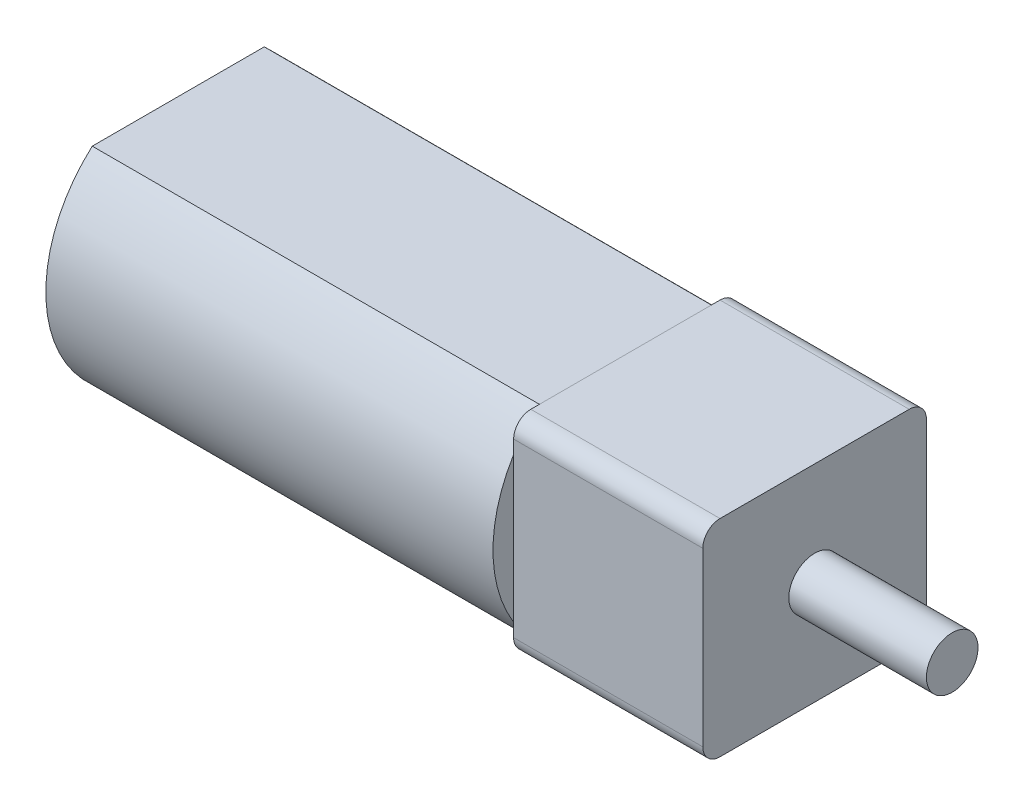
from build123d import *

# Parameters (mm, degrees)
EXTRUDE_1_DEPTH = 26
SKETCH_2_W      = 13
SKETCH_2_H      = 12
EXTRUDE_2_DEPTH = 11
SKETCH_3_R      = 1.5
EXTRUDE_3_DEPTH = 8
SKETCH_4_R      = 2.5
EXTRUDE_4_DEPTH = 2
FILLET_1_R      = 0.5
FILLET_2_R      = 1


with BuildPart() as part:
    # Эскиз1 → Бобышка-Вытянуть1 (new body)
    with BuildSketch(Plane(origin=(0, 0, 0), x_dir=(0, 0, -1), z_dir=(1, 0, 0))):
        with BuildLine():
            Line((2.7, 12), (12.7, 12))
            ThreePointArc((12.7, 12), (15.4, 6), (12.7, 0))
            Line((12.7, 0), (2.7, 0))
            ThreePointArc((2.7, 0), (0, 6), (2.7, 12))
        make_face()
    extrude(amount=EXTRUDE_1_DEPTH)

    # Эскиз4 → Бобышка-Вытянуть4 (add)
    with BuildSketch(Plane.ZY):
        with Locations((-7.7, 6)):
            Circle(SKETCH_4_R)
    extrude(amount=EXTRUDE_4_DEPTH)

    # Скругление1
    fillet_1_edges = [part.edges().sort_by_distance(p)[0] for p in [
        (-2, 6, -10.2),
    ]]
    fillet(fillet_1_edges, radius=FILLET_1_R)


with BuildPart() as body_2:
    # Эскиз2 → Бобышка-Вытянуть2 (new body)
    with BuildSketch(Plane(origin=(26, 0, 0), x_dir=(0, 0, -1), z_dir=(1, 0, 0))):
        with Locations((7.7, 6)):
            Rectangle(SKETCH_2_W, SKETCH_2_H)
    extrude(amount=EXTRUDE_2_DEPTH)

    # Скругление2
    fillet_2_edges = [body_2.edges().sort_by_distance(p)[0] for p in [
        (31.5, 0, -14.2),
        (31.5, 0, -1.2),
        (31.5, 12, -1.2),
        (31.5, 12, -14.2),
    ]]
    fillet(fillet_2_edges, radius=FILLET_2_R)


with BuildPart() as body_3:
    # Эскиз3 → Бобышка-Вытянуть3 (new body)
    with BuildSketch(Plane(origin=(37, 0, 0), x_dir=(0, 0, -1), z_dir=(1, 0, 0))):
        with Locations((7.7, 6)):
            Circle(SKETCH_3_R)
    extrude(amount=EXTRUDE_3_DEPTH)


solid = Compound([part.part, body_2.part, body_3.part])
